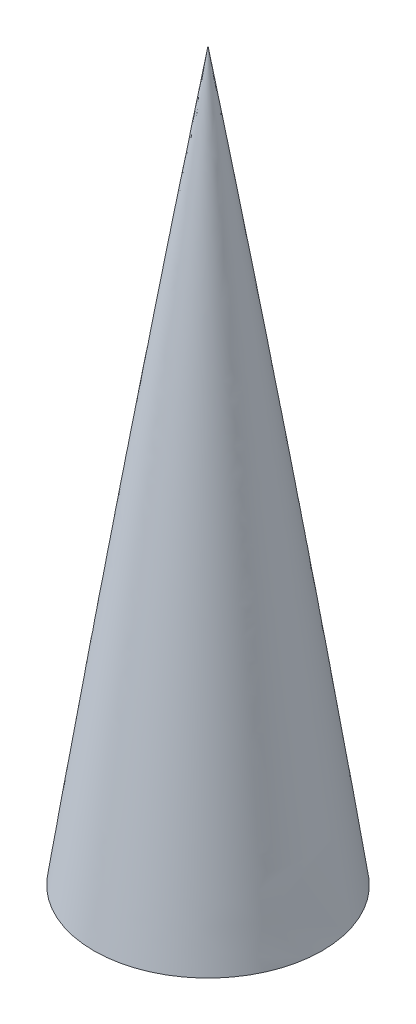
from build123d import *


with BuildPart() as part:
    # Sketch1 → Revolve1 (revolve)
    with BuildSketch(Plane.XY):
        with BuildLine():
            Line((-11.969787482, 533.4), (0, 533.4))
            Line((0, 533.4), (0, 609.6))
            ThreePointArc((0, 609.6), (-6.18438473, 571.531336808), (-11.969787482, 533.4))
        make_face()
    revolve(axis=Axis((0, 533.4, 0), (0, 1, 0)))


solid = part.part
